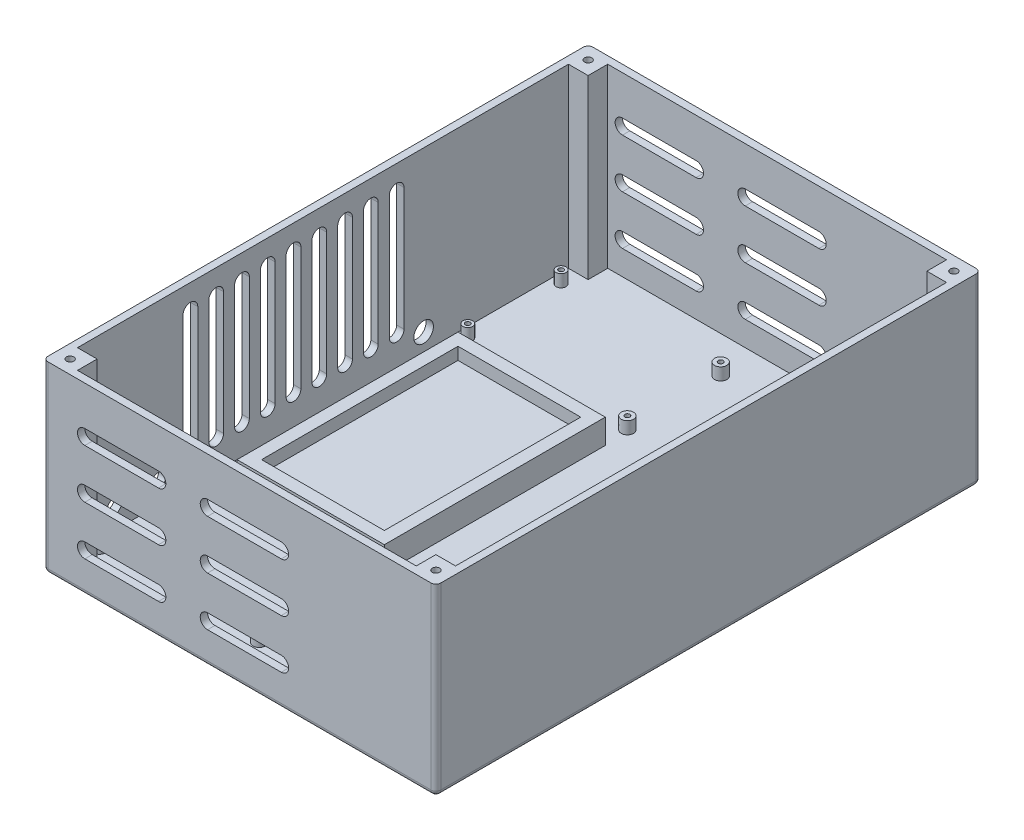
from build123d import *

# Parameters (mm, degrees)
SKETCH1_W           = 160
SKETCH1_H           = 222
BOSS_EXTRUDE1_DEPTH = 75
SKETCH2_W           = 154
SKETCH2_H           = 216
CUT_EXTRUDE1_DEPTH  = 72
SKETCH3_R           = 2
SKETCH3_R_2         = 1
SKETCH3_R_3         = 2.5
BOSS_EXTRUDE2_DEPTH = 5
SKETCH4_W           = 8
SKETCH4_H           = 8
BOSS_EXTRUDE3_DEPTH = 72
FILLET4_R           = 2
SKETCH5_R           = 1.5
CUT_EXTRUDE3_DEPTH  = 25
CUT_EXTRUDE8_DEPTH  = 3
CUT_EXTRUDE10_START = -3
CUT_EXTRUDE10_DEPTH = 3
SKETCH10_W          = 60
SKETCH10_H          = 90
BOSS_EXTRUDE5_DEPTH = 5
SKETCH12_W          = 60
SKETCH12_H          = 90
SKETCH12_W_2        = 50
SKETCH12_H_2        = 80
BOSS_EXTRUDE6_DEPTH = 5
SKETCH6_R           = 3
CUT_EXTRUDE14_DEPTH = 3
SKETCH7_R           = 4
CUT_EXTRUDE15_DEPTH = 3


with BuildPart() as part:
    # Sketch1 → Boss-Extrude1 (new body)
    with BuildSketch(Plane(origin=(0, 0, 0), x_dir=(1, 0, 0), z_dir=(0, 1, 0))):
        Rectangle(SKETCH1_W, SKETCH1_H)
    extrude(amount=BOSS_EXTRUDE1_DEPTH)

    # Sketch2 → Cut-Extrude1 (cut)
    with BuildSketch(Plane(origin=(0, 75, 0), x_dir=(1, 0, 0), z_dir=(0, 1, 0))):
        Rectangle(SKETCH2_W, SKETCH2_H)
    extrude(amount=-CUT_EXTRUDE1_DEPTH, mode=Mode.SUBTRACT)

    # Sketch3 → Boss-Extrude2 (add)
    # profile 1 of 12: a face of its own
    with BuildSketch(Plane(origin=(0, 3, 0), x_dir=(1, 0, 0), z_dir=(0, 1, 0))):
        with Locations(Location((-73, -95, 0), (0, 0, 270))):
            Circle(SKETCH3_R)
        with Locations(Location((-73, -95, 0), (0, 0, 270))):
            Circle(SKETCH3_R_2, mode=Mode.SUBTRACT)
    # profile 2 of 12: a face of its own
    with BuildSketch(Plane(origin=(0, 3, 0), x_dir=(1, 0, 0), z_dir=(0, 1, 0))):
        with Locations(Location((-73, -57.5, 0), (0, 0, 270))):
            Circle(SKETCH3_R)
        with Locations(Location((-73, -57.5, 0), (0, 0, 270))):
            Circle(SKETCH3_R_2, mode=Mode.SUBTRACT)
    # profile 3 of 12: a face of its own
    with BuildSketch(Plane(origin=(0, 3, 0), x_dir=(1, 0, 0), z_dir=(0, 1, 0))):
        with Locations(Location((-73, 55, 0), (0, 0, 270))):
            Circle(SKETCH3_R)
        with Locations(Location((-73, 55, 0), (0, 0, 270))):
            Circle(SKETCH3_R_2, mode=Mode.SUBTRACT)
    # profile 4 of 12: a face of its own
    with BuildSketch(Plane(origin=(0, 3, 0), x_dir=(1, 0, 0), z_dir=(0, 1, 0))):
        with Locations(Location((-73, 93, 0), (0, 0, 270))):
            Circle(SKETCH3_R)
        with Locations(Location((-73, 93, 0), (0, 0, 270))):
            Circle(SKETCH3_R_2, mode=Mode.SUBTRACT)
    # profile 5 of 12: a face of its own
    with BuildSketch(Plane(origin=(0, 3, 0), x_dir=(1, 0, 0), z_dir=(0, 1, 0))):
        with Locations(Location((63, -94, 0), (0, 0, 270))):
            Circle(SKETCH3_R_3)
        with Locations(Location((63, -94, 0), (0, 0, 270))):
            Circle(SKETCH3_R_2, mode=Mode.SUBTRACT)
    # profile 6 of 12: a face of its own
    with BuildSketch(Plane(origin=(0, 3, 0), x_dir=(1, 0, 0), z_dir=(0, 1, 0))):
        with Locations(Location((63, 94, 0), (0, 0, 270))):
            Circle(SKETCH3_R_3)
        with Locations(Location((63, 94, 0), (0, 0, 270))):
            Circle(SKETCH3_R_2, mode=Mode.SUBTRACT)
    # profile 7 of 12: a face of its own
    with BuildSketch(Plane(origin=(0, 3, 0), x_dir=(1, 0, 0), z_dir=(0, 1, 0))):
        with Locations(Location((-8, -95, 0), (0, 0, 270))):
            Circle(SKETCH3_R_3)
        with Locations(Location((-8, -95, 0), (0, 0, 270))):
            Circle(SKETCH3_R_2, mode=Mode.SUBTRACT)
    # profile 8 of 12: a face of its own
    with BuildSketch(Plane(origin=(0, 3, 0), x_dir=(1, 0, 0), z_dir=(0, 1, 0))):
        with Locations(Location((-8, -57, 0), (0, 0, 270))):
            Circle(SKETCH3_R_3)
        with Locations(Location((-8, -57, 0), (0, 0, 270))):
            Circle(SKETCH3_R_2, mode=Mode.SUBTRACT)
    # profile 9 of 12: a face of its own
    with BuildSketch(Plane(origin=(0, 3, 0), x_dir=(1, 0, 0), z_dir=(0, 1, 0))):
        with Locations(Location((-8, 55, 0), (0, 0, 270))):
            Circle(SKETCH3_R_3)
        with Locations(Location((-8, 55, 0), (0, 0, 270))):
            Circle(SKETCH3_R_2, mode=Mode.SUBTRACT)
    # profile 10 of 12: a face of its own
    with BuildSketch(Plane(origin=(0, 3, 0), x_dir=(1, 0, 0), z_dir=(0, 1, 0))):
        with Locations(Location((-8, 93, 0), (0, 0, 270))):
            Circle(SKETCH3_R_3)
        with Locations(Location((-8, 93, 0), (0, 0, 270))):
            Circle(SKETCH3_R_2, mode=Mode.SUBTRACT)
    # profile 11 of 12: a face of its own
    with BuildSketch(Plane(origin=(0, 3, 0), x_dir=(1, 0, 0), z_dir=(0, 1, 0))):
        with Locations(Location((13.537224538, 0.071428571, 0), (0, 0, 270))):
            Circle(SKETCH3_R_3)
        with Locations(Location((13.537224538, 0.071428571, 0), (0, 0, 270))):
            Circle(SKETCH3_R_2, mode=Mode.SUBTRACT)
    # profile 12 of 12: a face of its own
    with BuildSketch(Plane(origin=(0, 3, 0), x_dir=(1, 0, 0), z_dir=(0, 1, 0))):
        with Locations(Location((68.258558041, 5.344866071, 0), (0, 0, 270))):
            Circle(SKETCH3_R_3)
        with Locations(Location((68.258558041, 5.344866071, 0), (0, 0, 270))):
            Circle(SKETCH3_R_2, mode=Mode.SUBTRACT)
    extrude(amount=BOSS_EXTRUDE2_DEPTH)

    # Sketch4 → Boss-Extrude3 (add)
    with BuildSketch(Plane(origin=(0, 3, 0), x_dir=(1, 0, 0), z_dir=(0, 1, 0))):
        with Locations((-73, -104)):
            Rectangle(SKETCH4_W, SKETCH4_H)
        with Locations((-73, 104)):
            Rectangle(SKETCH4_W, SKETCH4_H)
        with Locations((73, 104)):
            Rectangle(SKETCH4_W, SKETCH4_H)
        with Locations((73, -104)):
            Rectangle(SKETCH4_W, SKETCH4_H)
    extrude(amount=BOSS_EXTRUDE3_DEPTH)

    # Fillet4
    fillet4_edges = [part.edges().sort_by_distance(p)[0] for p in [
        (0, 0, 111),
        (-80, 0, 0),
        (0, 0, -111),
        (80, 0, 0),
        (80, 37.5, 111),
        (-80, 37.5, 111),
        (-80, 37.5, -111),
        (80, 37.5, -111),
    ]]
    fillet(fillet4_edges, radius=FILLET4_R)

    # Sketch5 → Cut-Extrude3 (cut)
    with BuildSketch(Plane(origin=(0, 75, 0), x_dir=(1, 0, 0), z_dir=(0, 1, 0))):
        with Locations(Location((-74.5, 105.5, 0), (0, 0, 270))):
            Circle(SKETCH5_R)
        with Locations(Location((74.5, 105.5, 0), (0, 0, 270))):
            Circle(SKETCH5_R)
        with Locations(Location((74.5, -105.5, 0), (0, 0, 270))):
            Circle(SKETCH5_R)
        with Locations(Location((-74.5, -105.5, 0), (0, 0, 270))):
            Circle(SKETCH5_R)
    extrude(amount=-CUT_EXTRUDE3_DEPTH, mode=Mode.SUBTRACT)

    # Sketch8 → Cut-Extrude8 (cut)
    with BuildSketch(Plane.XY.offset(111)):
        with BuildLine():
            Line((-63, 59), (-33, 59))
            ThreePointArc((-33, 59), (-30, 56), (-33, 53))
            Line((-33, 53), (-63, 53))
            ThreePointArc((-63, 53), (-66, 56), (-63, 59))
        make_face()
        with BuildLine():
            Line((-13, 59), (17, 59))
            ThreePointArc((17, 59), (20, 56), (17, 53))
            Line((17, 53), (-13, 53))
            ThreePointArc((-13, 53), (-16, 56), (-13, 59))
        make_face()
        with BuildLine():
            Line((-63, 39), (-33, 39))
            ThreePointArc((-33, 39), (-30, 36), (-33, 33))
            Line((-33, 33), (-63, 33))
            ThreePointArc((-63, 33), (-66, 36), (-63, 39))
        make_face()
        with BuildLine():
            Line((17, 33), (-13, 33))
            ThreePointArc((-13, 33), (-16, 36), (-13, 39))
            Line((-13, 39), (17, 39))
            ThreePointArc((17, 39), (20, 36), (17, 33))
        make_face()
        with BuildLine():
            Line((-63, 19), (-33, 19))
            ThreePointArc((-33, 19), (-30, 16), (-33, 13))
            Line((-33, 13), (-63, 13))
            ThreePointArc((-63, 13), (-66, 16), (-63, 19))
        make_face()
        with BuildLine():
            Line((-13, 19), (17, 19))
            ThreePointArc((17, 19), (20, 16), (17, 13))
            Line((17, 13), (-13, 13))
            ThreePointArc((-13, 13), (-16, 16), (-13, 19))
        make_face()
    extrude(amount=-CUT_EXTRUDE8_DEPTH, mode=Mode.SUBTRACT)

    # Sketch9 → Cut-Extrude10 (cut)
    with BuildSketch(Plane(origin=(0, 0, -111), x_dir=(-1, 0, 0), z_dir=(0, 0, -1)).offset(CUT_EXTRUDE10_START)):
        with BuildLine():
            Line((-17, 59), (13, 59))
            ThreePointArc((13, 59), (16, 56), (13, 53))
            Line((13, 53), (-17, 53))
            ThreePointArc((-17, 53), (-20, 56), (-17, 59))
        make_face()
        with BuildLine():
            Line((33, 59), (63, 59))
            ThreePointArc((63, 59), (66, 56), (63, 53))
            Line((63, 53), (33, 53))
            ThreePointArc((33, 53), (30, 56), (33, 59))
        make_face()
        with BuildLine():
            Line((-17, 39), (13, 39))
            ThreePointArc((13, 39), (16, 36), (13, 33))
            Line((13, 33), (-17, 33))
            ThreePointArc((-17, 33), (-20, 36), (-17, 39))
        make_face()
        with BuildLine():
            Line((33, 39), (63, 39))
            ThreePointArc((63, 39), (66, 36), (63, 33))
            Line((63, 33), (33, 33))
            ThreePointArc((33, 33), (30, 36), (33, 39))
        make_face()
        with BuildLine():
            Line((-17, 19), (13, 19))
            ThreePointArc((13, 19), (16, 16), (13, 13))
            Line((13, 13), (-17, 13))
            ThreePointArc((-17, 13), (-20, 16), (-17, 19))
        make_face()
        with BuildLine():
            Line((33, 19), (63, 19))
            ThreePointArc((63, 19), (66, 16), (63, 13))
            Line((63, 13), (33, 13))
            ThreePointArc((33, 13), (30, 16), (33, 19))
        make_face()
    extrude(amount=CUT_EXTRUDE10_DEPTH, mode=Mode.SUBTRACT)

    # Sketch10 → Boss-Extrude5 (add)
    with BuildSketch(Plane(origin=(0, 3, 0), x_dir=(1, 0, 0), z_dir=(0, 1, 0))):
        with Locations((-37, 0)):
            Rectangle(SKETCH10_W, SKETCH10_H)
    extrude(amount=BOSS_EXTRUDE5_DEPTH)

    # Sketch12 → Boss-Extrude6 (add)
    with BuildSketch(Plane(origin=(0, 8, 0), x_dir=(1, 0, 0), z_dir=(0, 1, 0))):
        with Locations((-37, 0)):
            Rectangle(SKETCH12_W, SKETCH12_H)
        with Locations((-37, 0)):
            Rectangle(SKETCH12_W_2, SKETCH12_H_2, mode=Mode.SUBTRACT)
    extrude(amount=BOSS_EXTRUDE6_DEPTH)

    # Sketch6 → Cut-Extrude14 (cut)
    with BuildSketch(Plane(origin=(-77, 0, 0), x_dir=(0, 0, -1), z_dir=(1, 0, 0))):
        with Locations((-85, 11.5)):
            Circle(SKETCH6_R)
        with Locations((-67, 11.5)):
            Circle(SKETCH6_R)
    extrude(amount=-CUT_EXTRUDE14_DEPTH, mode=Mode.SUBTRACT)

    # Sketch7 → Cut-Extrude15 (cut)
    with BuildSketch(Plane.ZY.offset(80)):
        with Locations((-41, 10)):
            Circle(SKETCH7_R)
        with BuildLine():
            Line((-27, 65), (-27, 15))
            ThreePointArc((-27, 15), (-30, 12), (-33, 15))
            Line((-33, 15), (-33, 65))
            ThreePointArc((-33, 65), (-30, 68), (-27, 65))
        make_face()
        with BuildLine():
            Line((-6, 65), (-6, 15))
            ThreePointArc((-6, 15), (-9, 12), (-12, 15))
            Line((-12, 15), (-12, 65))
            ThreePointArc((-12, 65), (-9, 68), (-6, 65))
        make_face()
        with BuildLine():
            Line((15, 65), (15, 15))
            ThreePointArc((15, 15), (12, 12), (9, 15))
            Line((9, 15), (9, 65))
            ThreePointArc((9, 65), (12, 68), (15, 65))
        make_face()
        with BuildLine():
            Line((25.5, 65), (25.5, 15))
            ThreePointArc((25.5, 15), (22.5, 12), (19.5, 15))
            Line((19.5, 15), (19.5, 65))
            ThreePointArc((19.5, 65), (22.5, 68), (25.5, 65))
        make_face()
        with BuildLine():
            Line((36, 65), (36, 15))
            ThreePointArc((36, 15), (33, 12), (30, 15))
            Line((30, 15), (30, 65))
            ThreePointArc((30, 65), (33, 68), (36, 65))
        make_face()
        with BuildLine():
            Line((46.5, 65), (46.5, 15))
            ThreePointArc((46.5, 15), (43.5, 12), (40.5, 15))
            Line((40.5, 15), (40.5, 65))
            ThreePointArc((40.5, 65), (43.5, 68), (46.5, 65))
        make_face()
        with BuildLine():
            Line((-16.5, 65), (-16.5, 15))
            ThreePointArc((-16.5, 15), (-19.5, 12), (-22.5, 15))
            Line((-22.5, 15), (-22.5, 65))
            ThreePointArc((-22.5, 65), (-19.5, 68), (-16.5, 65))
        make_face()
        with BuildLine():
            Line((4.5, 65), (4.5, 15))
            ThreePointArc((4.5, 15), (1.5, 12), (-1.5, 15))
            Line((-1.5, 15), (-1.5, 65))
            ThreePointArc((-1.5, 65), (1.5, 68), (4.5, 65))
        make_face()
        with BuildLine():
            Line((57, 65), (57, 15))
            ThreePointArc((57, 15), (54, 12), (51, 15))
            Line((51, 15), (51, 65))
            ThreePointArc((51, 65), (54, 68), (57, 65))
        make_face()
    extrude(amount=-CUT_EXTRUDE15_DEPTH, mode=Mode.SUBTRACT)


solid = part.part
